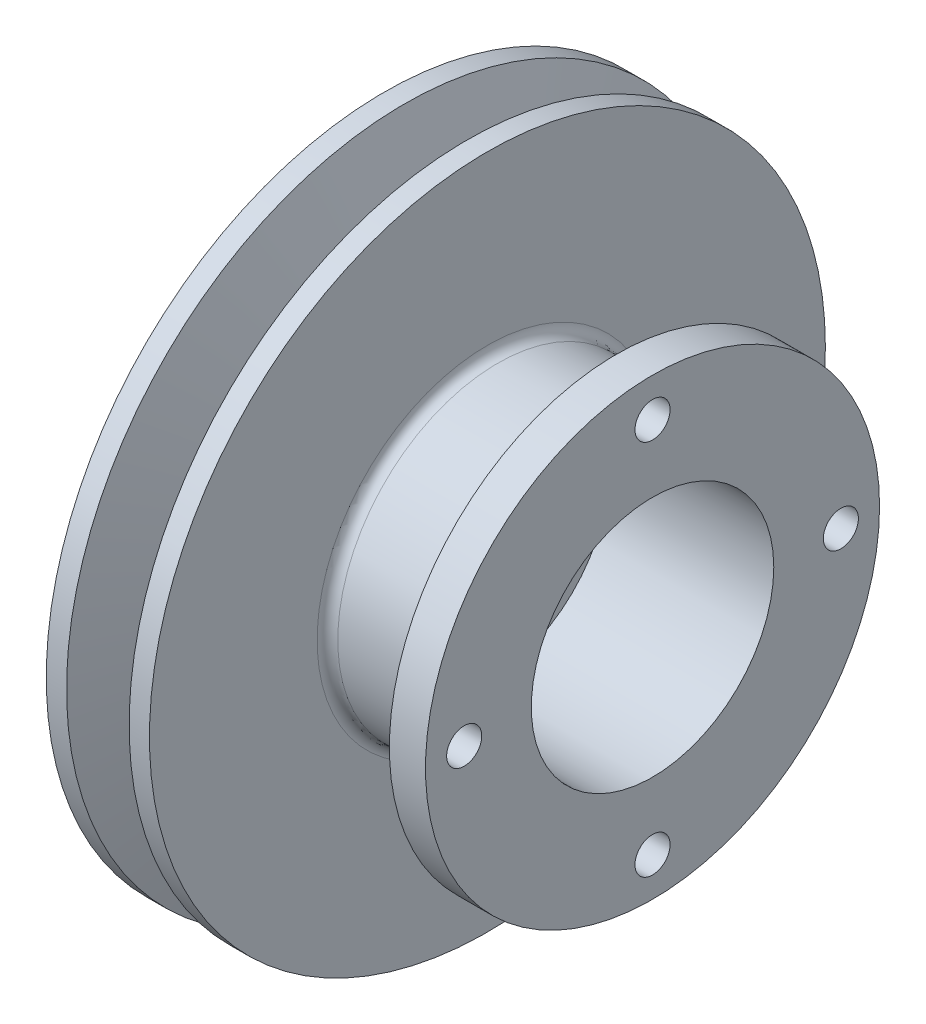
from build123d import *

# Parameters (mm, degrees)
CHAMFER1_SIZE     = 1
FILLET1_R         = 2
CIRPATTERN1_COUNT = 4


with BuildPart() as part:
    # Sketch1 → Revolve1 (revolve)
    with BuildSketch(Plane.XY, mode=Mode.PRIVATE) as revolve1_sk:
        Polygon((0, 0), (0, 44), (-7, 44), (-7, 31), (-32, 31), (-32, 65.5), (-35.937861367, 65.5), (-39.99935757, 53), (-44.00064243, 53), (-48.062138633, 65.5), (-52, 65.5), (-52, 46), (-39, 46), (-39, 38), (-66, 38), (-66, 0), align=None)
    revolve(revolve1_sk.sketch.rotate(Axis((0, 0, 0), (-1, 0, 0)), 90), axis=Axis((0, 0, 0), (-1, 0, 0)))

    # Sketch2 → Cut-Revolve1 (revolve, cut)
    with BuildSketch(Plane.XY, mode=Mode.PRIVATE) as cut_revolve1_sk:
        Polygon((0, 0), (0, 23.5), (-32, 23.5), (-32, 20), (-36, 20), (-39, 23), (-39, 31), (-55, 31), (-55, 34), (-58, 34), (-58, 30), (-66, 30), (-66, 0), align=None)
    revolve(cut_revolve1_sk.sketch.rotate(Axis((0, 0, 0), (-1, 0, 0)), 90), axis=Axis((0, 0, 0), (-1, 0, 0)), mode=Mode.SUBTRACT)

    # Chamfer1
    chamfer1_edges = [part.edges().sort_by_distance(p)[0] for p in [
        (-55, 0, 31),
    ]]
    chamfer(chamfer1_edges, length=CHAMFER1_SIZE)

    # Fillet1
    fillet1_edges = [part.edges().sort_by_distance(p)[0] for p in [
        (-39, 0, 38),
        (-39, 0, 46),
        (-52, 0, 46),
        (-32, 0, 31),
        (-7, 0, 31),
    ]]
    fillet(fillet1_edges, radius=FILLET1_R)

    # Sketch4 → M8 Tapped Hole1 (revolve, cut)
    with BuildSketch(Plane(origin=(0, 36.5, 0), x_dir=(0, 0, -1), z_dir=(0, 1, 0))):
        Polygon((0, 0), (0, 9.042926105), (3.4, 7), (3.4, 0), align=None)
    m8_tapped_hole1 = revolve(axis=Axis((6.35, 36.5, 0), (-1, 0, 0)), mode=Mode.SUBTRACT)

    # CirPattern1: M8 Tapped Hole1 ×4 about axis
    cirpattern1_axis = Axis((0, 0, 0), (1, 0, 0))
    for i in range(1, CIRPATTERN1_COUNT):
        add(m8_tapped_hole1.rotate(cirpattern1_axis, i * 360 / CIRPATTERN1_COUNT), mode=Mode.SUBTRACT)


solid = part.part
